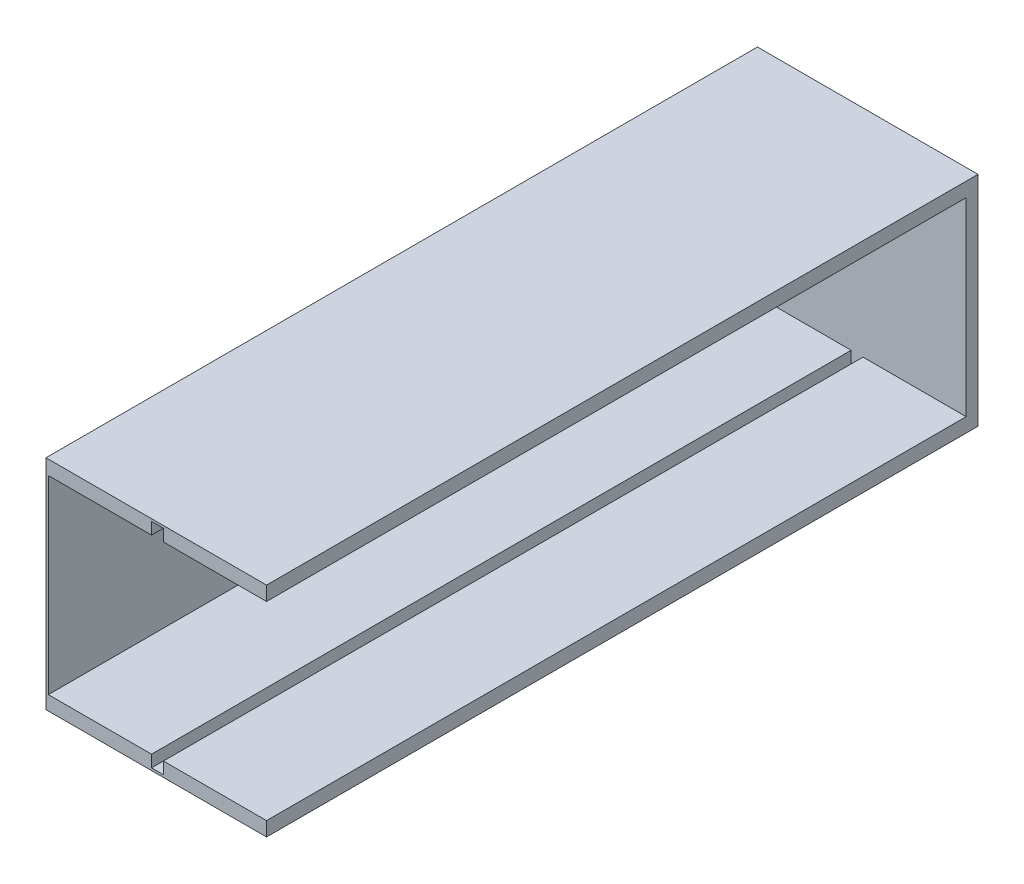
from build123d import *

# Parameters (mm, degrees)
BOSS_EXTRUDE1_DEPTH   = 1500
BOSS_EXTRUDE1_2_DEPTH = 1500
SKETCH5_W             = 460
SKETCH5_H             = 460
BOSS_EXTRUDE5_DEPTH   = 25
SKETCH6_W             = 1500
SKETCH6_H             = 460
BOSS_EXTRUDE6_DEPTH   = 5


with BuildPart() as part:
    # Sketch1 → Boss-Extrude1 (new body)
    with BuildSketch(Plane.XY):
        Polygon((0, -30), (217.5, -30), (217.5, -5), (242.5, -5), (242.5, -30), (460, -30), (460, 0), (0, 0), align=None)
    extrude(amount=BOSS_EXTRUDE1_DEPTH)



with BuildPart() as body_2:
    # Sketch1 → Boss-Extrude1 2 (new body)
    with BuildSketch(Plane.XY):
        Polygon((242.5, -430), (460, -430), (460, -460), (0, -460), (0, -430), (217.5, -430), (217.5, -455), (242.5, -455), align=None)
    extrude(amount=BOSS_EXTRUDE1_2_DEPTH)


with BuildPart() as part_1:
    add(part.part)

    add(body_2.part)  # Boss-Extrude5 merges body 2
    # Sketch5 → Boss-Extrude5 (add)
    with BuildSketch(Plane(origin=(0, 0, 0), x_dir=(-1, 0, 0), z_dir=(0, 0, -1))):
        with Locations((-230, -230)):
            Rectangle(SKETCH5_W, SKETCH5_H)
    extrude(amount=-BOSS_EXTRUDE5_DEPTH)

    # Sketch6 → Boss-Extrude6 (add)
    with BuildSketch(Plane.ZY):
        with Locations((750, -230)):
            Rectangle(SKETCH6_W, SKETCH6_H)
    extrude(amount=BOSS_EXTRUDE6_DEPTH)


solid = part_1.part
